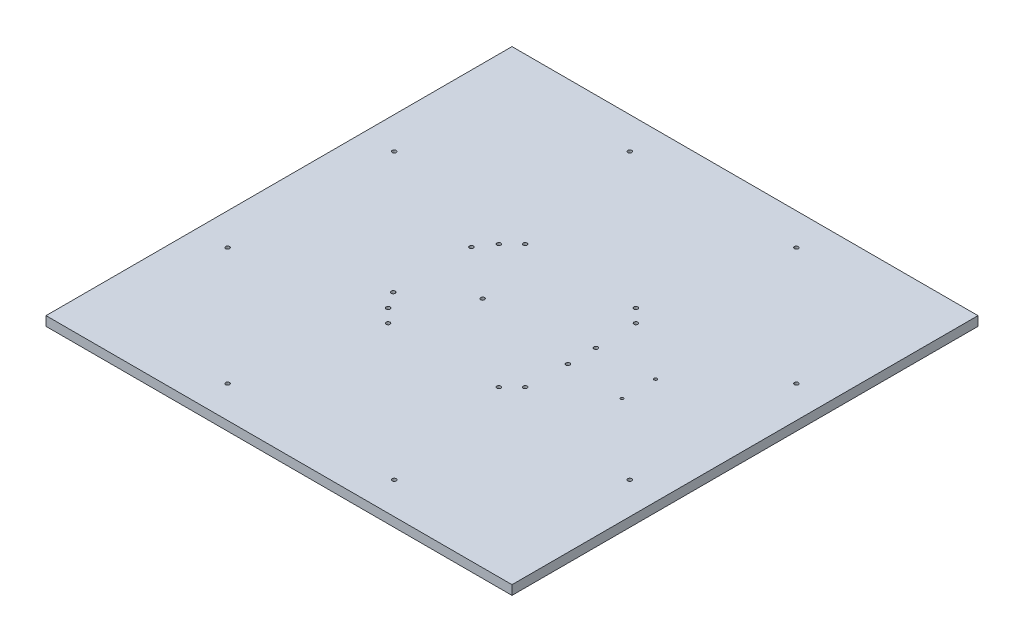
from build123d import *

# Parameters (mm, degrees)
ESQUISSE1_W                  = 500
ESQUISSE1_H                  = 500
BOSS_EXTRU_1_DEPTH           = 10
ESQUISSE2_R                  = 2.1
ENL_V_MAT_EXTRU_1_DEPTH      = 354.694783677
R_P_TITION_CIRCULAIRE1_COUNT = 8
ESQUISSE3_R                  = 2.1
ENL_V_MAT_EXTRU_2_DEPTH      = 354.694783677
R_P_TITION_CIRCULAIRE2_COUNT = 4
ESQUISSE4_R                  = 2.1
ENL_V_MAT_EXTRU_3_DEPTH      = 354.694783677
ESQUISSE5_R                  = 1.6
ENL_V_MAT_EXTRU_4_DEPTH      = 354.694783677
ESQUISSE6_R                  = 2.1
ENL_V_MAT_EXTRU_7_DEPTH      = 354.694783677


with BuildPart() as part:
    # Esquisse1 → Boss.-Extru.1 (new body)
    with BuildSketch(Plane(origin=(0, 0, 0), x_dir=(1, 0, 0), z_dir=(0, 1, 0))):
        Rectangle(ESQUISSE1_W, ESQUISSE1_H)
    extrude(amount=BOSS_EXTRU_1_DEPTH)

    # Esquisse2 → Enlèv. mat.-Extru.1 (cut, through all)
    with BuildSketch(Plane(origin=(0, 0, 0), x_dir=(1, 0, 0), z_dir=(0, 1, 0))):
        with Locations((89.356581457, 215.725870841)):
            Circle(ESQUISSE2_R)
    enl_v_mat_extru_1 = extrude(amount=ENL_V_MAT_EXTRU_1_DEPTH, mode=Mode.SUBTRACT)

    # Répétition circulaire1: Enlèv. mat.-Extru.1 ×8 about axis
    r_p_tition_circulaire1_axis = Axis((0, -0.5, 0), (0, 1, 0))
    for i in range(1, R_P_TITION_CIRCULAIRE1_COUNT):
        add(enl_v_mat_extru_1.rotate(r_p_tition_circulaire1_axis, i * 360 / R_P_TITION_CIRCULAIRE1_COUNT), mode=Mode.SUBTRACT)

    # Esquisse3 → Enlèv. mat.-Extru.2 (cut, through all)
    with BuildSketch(Plane(origin=(0, 0, 0), x_dir=(1, 0, 0), z_dir=(0, 1, 0))):
        with Locations((59.39696962, 73.539105243)):
            Circle(ESQUISSE3_R)
        with Locations((73.539105243, 59.39696962)):
            Circle(ESQUISSE3_R)
    enl_v_mat_extru_2 = extrude(amount=ENL_V_MAT_EXTRU_2_DEPTH, mode=Mode.SUBTRACT)

    # Répétition circulaire2: Enlèv. mat.-Extru.2 ×4 about axis
    r_p_tition_circulaire2_axis = Axis((0, -0.5, 0), (0, 1, 0))
    for i in range(1, R_P_TITION_CIRCULAIRE2_COUNT):
        add(enl_v_mat_extru_2.rotate(r_p_tition_circulaire2_axis, i * 360 / R_P_TITION_CIRCULAIRE2_COUNT), mode=Mode.SUBTRACT)

    # Esquisse4 → Enlèv. mat.-Extru.3 (cut, through all)
    with BuildSketch(Plane(origin=(0, 0, 0), x_dir=(1, 0, 0), z_dir=(0, 1, 0))):
        with Locations((-85.5, 42)):
            Circle(ESQUISSE4_R)
        with Locations((-85.5, -42)):
            Circle(ESQUISSE4_R)
        with Locations((-31.5, 0)):
            Circle(ESQUISSE4_R)
    extrude(amount=ENL_V_MAT_EXTRU_3_DEPTH, mode=Mode.SUBTRACT)

    # Esquisse5 → Enlèv. mat.-Extru.4 (cut, through all)
    with BuildSketch(Plane.XZ):
        with Locations((136, -18)):
            Circle(ESQUISSE5_R)
        with Locations((136, 18)):
            Circle(ESQUISSE5_R)
    extrude(amount=-ENL_V_MAT_EXTRU_4_DEPTH, mode=Mode.SUBTRACT)

    # Esquisse6 → Enlèv. mat.-Extru.7 (cut, through all)
    with BuildSketch(Plane(origin=(0, 10, 0), x_dir=(1, 0, 0), z_dir=(0, 1, 0))):
        with Locations((75, 15)):
            Circle(ESQUISSE6_R)
        with Locations((75, -15)):
            Circle(ESQUISSE6_R)
    extrude(amount=-ENL_V_MAT_EXTRU_7_DEPTH, mode=Mode.SUBTRACT)


solid = part.part
